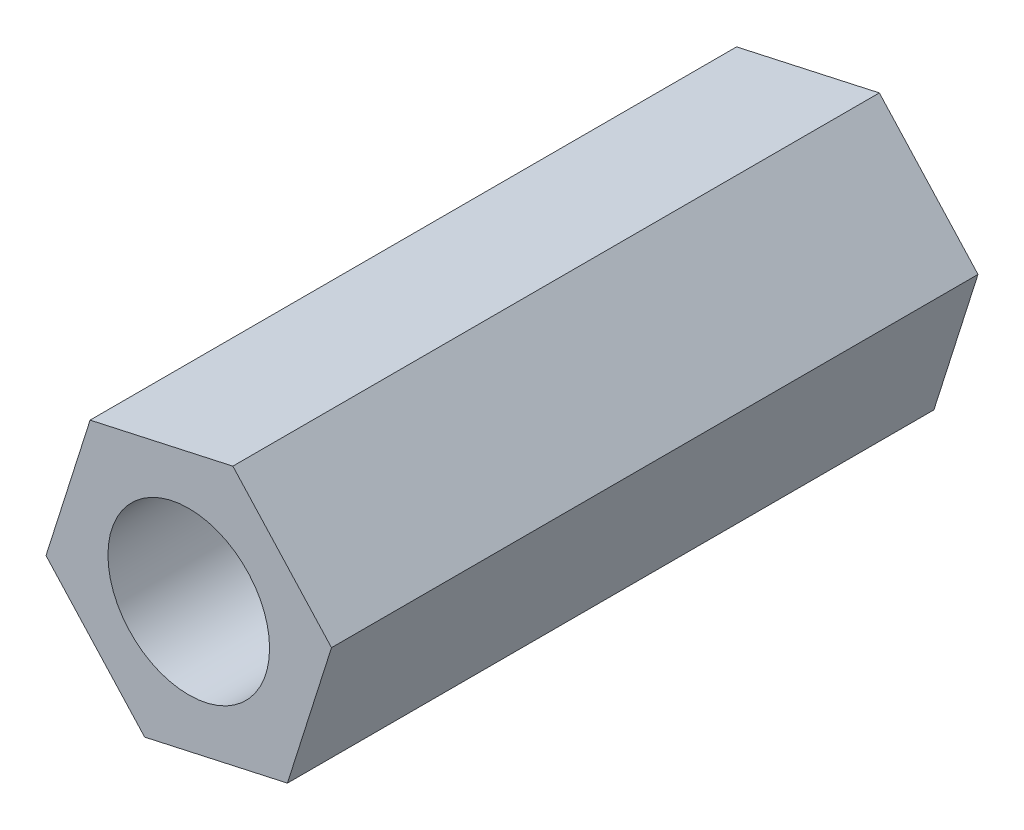
from build123d import *

# Parameters (mm, degrees)
SKETCH_1_R      = 1.5
EXTRUDE_1_DEPTH = 12


with BuildPart() as part:
    # 草图1 → 凸台-拉伸1 (new body)
    with BuildSketch(Plane.XY):
        Polygon((2.649803949, 0.584698524), (0.818538199, 2.587146797), (-1.83126575, 2.002448273), (-2.649803949, -0.584698524), (-0.818538199, -2.587146797), (1.83126575, -2.002448273), align=None)
        Circle(SKETCH_1_R, mode=Mode.SUBTRACT)
    extrude(amount=EXTRUDE_1_DEPTH)


solid = part.part
